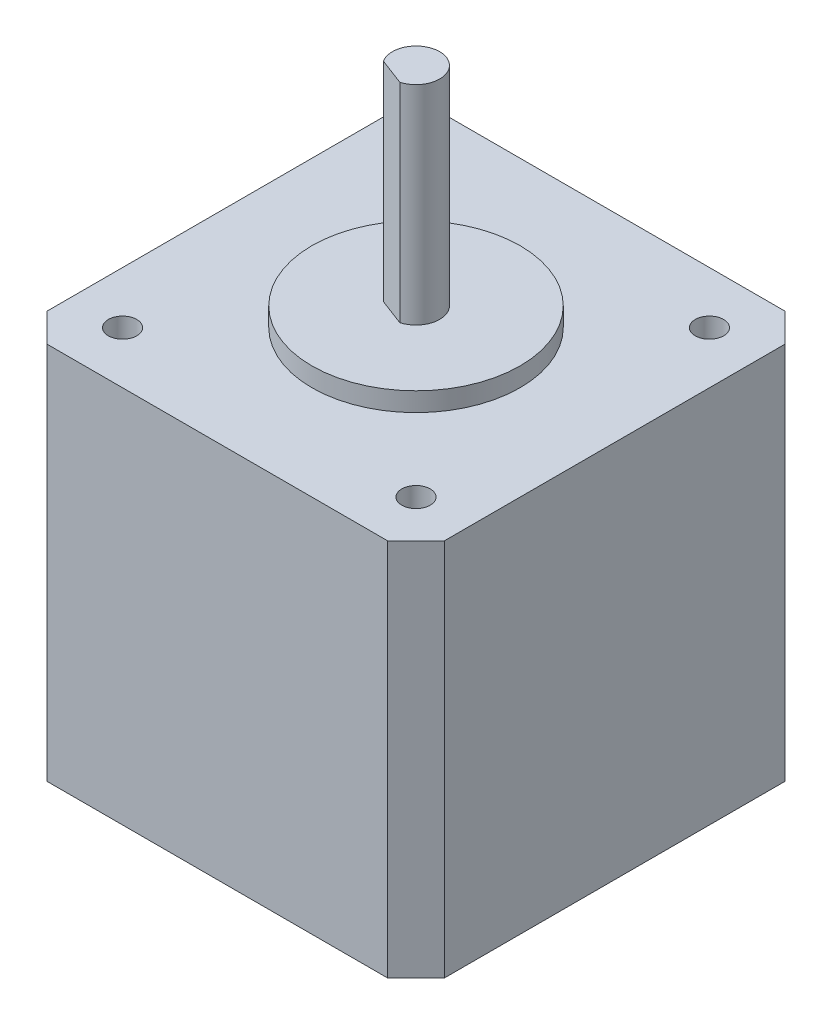
from build123d import *

# Parameters (mm, degrees)
SKETCH1_W               = 42
SKETCH1_H               = 42
BOSS_EXTRUDE1_DEPTH     = 40
CHAMFER1_SIZE           = 3
SKETCH2_R               = 11
BOSS_EXTRUDE2_DEPTH     = 2
SKETCH3_R               = 2.5
BOSS_EXTRUDE3_DEPTH     = 22
CUT_EXTRUDE1_DEPTH      = 88.315519812
CUT_EXTRUDE1_DEPTH_BACK = 22
SKETCH5_R               = 1.5
CUT_EXTRUDE2_DEPTH      = 10


with BuildPart() as part:
    # Sketch1 → Boss-Extrude1 (new body)
    with BuildSketch(Plane(origin=(0, 0, 0), x_dir=(1, 0, 0), z_dir=(0, 1, 0))):
        with Locations((21, 21)):
            Rectangle(SKETCH1_W, SKETCH1_H)
    extrude(amount=BOSS_EXTRUDE1_DEPTH)

    # Chamfer1
    chamfer1_edges = [part.edges().sort_by_distance(p)[0] for p in [
        (0, 20, -42),
        (42, 20, -42),
        (42, 20, 0),
        (0, 20, 0),
    ]]
    chamfer(chamfer1_edges, length=CHAMFER1_SIZE)

    # Sketch2 → Boss-Extrude2 (add)
    with BuildSketch(Plane(origin=(0, 40, 0), x_dir=(1, 0, 0), z_dir=(0, 1, 0))):
        with Locations(Location((21, 21, 0), (0, 0, 270))):
            Circle(SKETCH2_R)
    extrude(amount=BOSS_EXTRUDE2_DEPTH)

    # Sketch3 → Boss-Extrude3 (add)
    with BuildSketch(Plane(origin=(0, 42, 0), x_dir=(1, 0, 0), z_dir=(0, 1, 0))):
        with Locations(Location((21, 21, 0), (0, 0, 270))):
            Circle(SKETCH3_R)
    extrude(amount=BOSS_EXTRUDE3_DEPTH)

    # Sketch4 → Cut-Extrude1 (cut, two sides: drawn at the far end of the back side and taken through both)
    with BuildSketch(Plane(origin=(0, 64, 0), x_dir=(1, 0, 0), z_dir=(0, 1, 0)).offset(-CUT_EXTRUDE1_DEPTH_BACK)):
        Polygon((91.105119446, -7.851665626), (21.689600393, 18.596991199), (18.886199661, 19.665141159), (-50.529319392, 46.113797983), (-103.426633041, -92.717240123), (38.207805797, -146.682703732), align=None)
    extrude(amount=CUT_EXTRUDE1_DEPTH + CUT_EXTRUDE1_DEPTH_BACK, mode=Mode.SUBTRACT)

    # Sketch5 → Cut-Extrude2 (cut)
    with BuildSketch(Plane(origin=(0, 40, 0), x_dir=(1, 0, 0), z_dir=(0, 1, 0))):
        with Locations(Location((36.5, 36.5, 0), (0, 0, 270))):
            Circle(SKETCH5_R)
        with Locations(Location((36.5, 5.5, 0), (0, 0, 270))):
            Circle(SKETCH5_R)
        with Locations(Location((5.5, 5.5, 0), (0, 0, 270))):
            Circle(SKETCH5_R)
        with Locations(Location((5.5, 36.5, 0), (0, 0, 270))):
            Circle(SKETCH5_R)
    extrude(amount=-CUT_EXTRUDE2_DEPTH, mode=Mode.SUBTRACT)


solid = part.part
